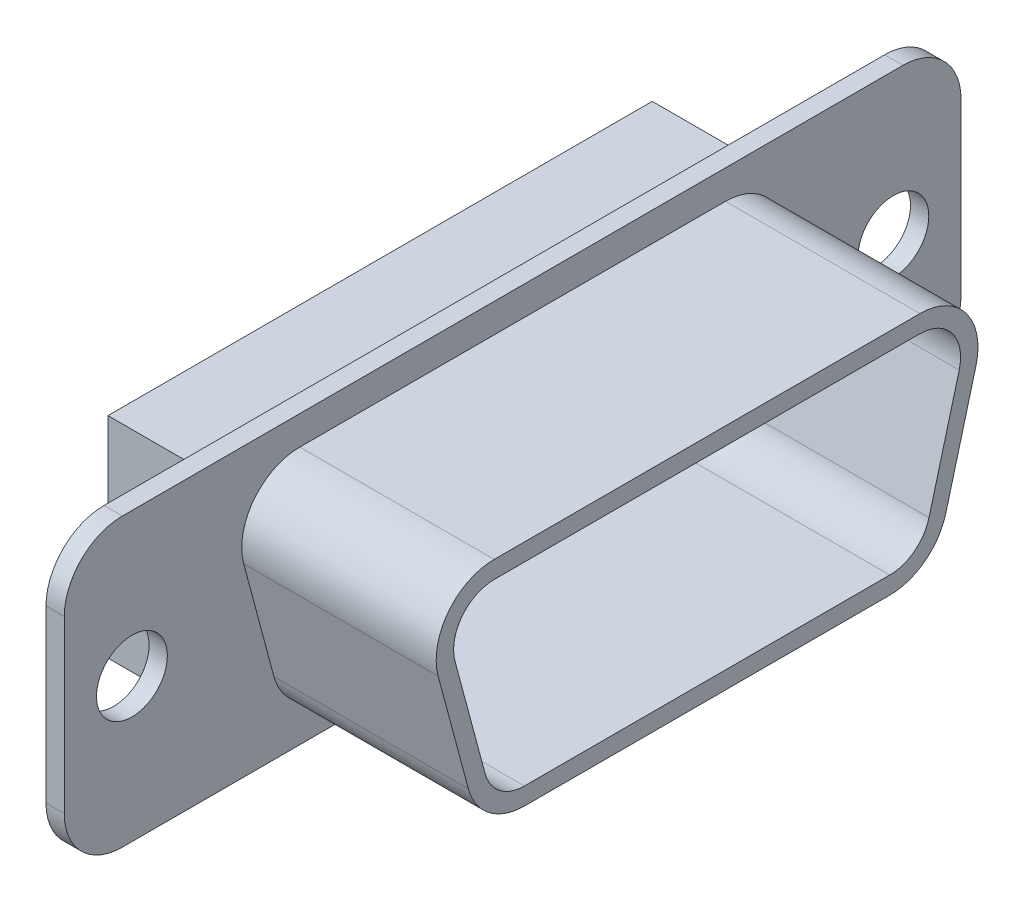
from build123d import *

# Parameters (mm, degrees)
BOSS_EXTRUDE1_DEPTH      = 0.8
BOSS_EXTRUDE2_DEPTH      = 8.509
CUT_EXTRUDE1_DEPTH       = 8.509
X_0_397_DIAMETER_HOLE1_D = 3.099999896
SKETCH8_W                = 23.81809924
SKETCH8_H                = 9.191548364
BOSS_EXTRUDE4_DEPTH      = 5


with BuildPart() as part:
    # Sketch1 → Boss-Extrude1 (new body)
    with BuildSketch(Plane(origin=(0, 0, 0), x_dir=(0, 0, -1), z_dir=(1, 0, 0))):
        with BuildLine():
            Line((-17.08, -6.275), (17.08, -6.275))
            ThreePointArc((17.08, -6.275), (18.876051224, -5.531051224), (19.62, -3.735))
            Line((19.62, -3.735), (19.62, 3.735))
            ThreePointArc((19.62, 3.735), (18.876051224, 5.531051224), (17.08, 6.275))
            Line((17.08, 6.275), (-17.08, 6.275))
            ThreePointArc((-17.08, 6.275), (-18.876051224, 5.531051224), (-19.62, 3.735))
            Line((-19.62, 3.735), (-19.62, -3.735))
            ThreePointArc((-19.62, -3.735), (-18.876051224, -5.531051224), (-17.08, -6.275))
        make_face()
    extrude(amount=BOSS_EXTRUDE1_DEPTH)

    # Sketch2 → Boss-Extrude2 (add)
    with BuildSketch(Plane(origin=(0.8, 0, 0), x_dir=(0, 0, -1), z_dir=(1, 0, 0))):
        with BuildLine():
            Line((-9.314807553, 5.005), (9.314807553, 5.005))
            ThreePointArc((9.314807553, 5.005), (11.329925037, 4.01125403), (11.768259152, 1.807599625))
            Line((11.768259152, 1.807599625), (10.447269633, -3.122400375))
            ThreePointArc((10.447269633, -3.122400375), (9.540072064, -4.480117484), (7.993818034, -5.005))
            Line((7.993818034, -5.005), (-7.993818034, -5.005))
            ThreePointArc((-7.993818034, -5.005), (-9.540072064, -4.480117484), (-10.447269633, -3.122400375))
            Line((-10.447269633, -3.122400375), (-11.768259152, 1.807599625))
            ThreePointArc((-11.768259152, 1.807599625), (-11.329925037, 4.01125403), (-9.314807553, 5.005))
        make_face()
    extrude(amount=BOSS_EXTRUDE2_DEPTH)

    # Sketch3 → Cut-Extrude1 (cut)
    with BuildSketch(Plane(origin=(9.309, 0, 0), x_dir=(0, 0, -1), z_dir=(1, 0, 0))):
        with BuildLine():
            Line((-11.032223672, 2.004819738), (-9.711234153, -2.925180262))
            ThreePointArc((-9.711234153, -2.925180262), (-9.076195855, -3.875582239), (-7.993818034, -4.243))
            Line((-7.993818034, -4.243), (7.993818034, -4.243))
            ThreePointArc((7.993818034, -4.243), (9.076195855, -3.875582239), (9.711234153, -2.925180262))
            Line((9.711234153, -2.925180262), (11.032223672, 2.004819738))
            ThreePointArc((11.032223672, 2.004819738), (10.725389792, 3.547377821), (9.314807553, 4.243))
            Line((9.314807553, 4.243), (-9.314807553, 4.243))
            ThreePointArc((-9.314807553, 4.243), (-10.725389792, 3.547377821), (-11.032223672, 2.004819738))
        make_face()
    extrude(amount=-CUT_EXTRUDE1_DEPTH, mode=Mode.SUBTRACT)

    # X (0.397) Diameter Hole1 (through all)
    with Locations(Plane(origin=(0.8, 0, 0), x_dir=(0, 0, -1), z_dir=(1, 0, 0))):
        with Locations((-16.66, 0), (16.66, 0)):
            Hole(X_0_397_DIAMETER_HOLE1_D / 2)

    # Sketch8 → Boss-Extrude4 (add)
    with BuildSketch(Plane.ZY):
        Rectangle(SKETCH8_W, SKETCH8_H)
    extrude(amount=BOSS_EXTRUDE4_DEPTH)


solid = part.part
